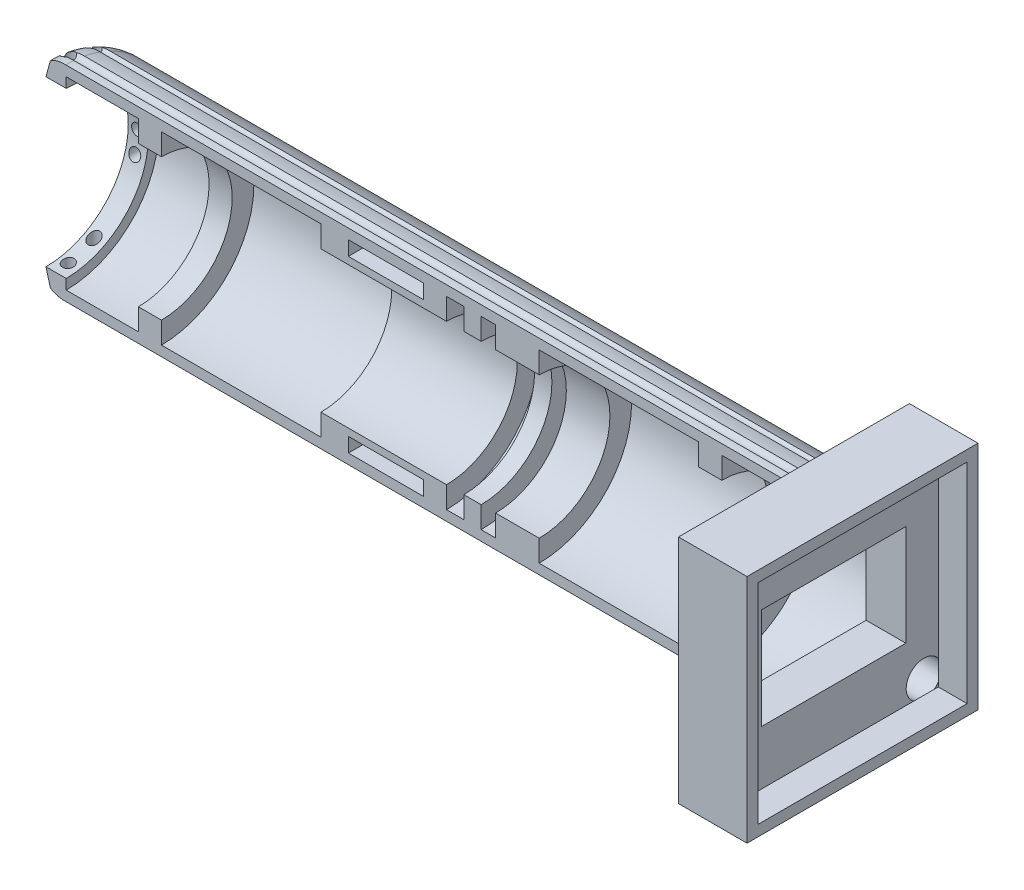
from build123d import *

# Parameters (mm, degrees)
REVOLVE1_ANGLE      = 180
SKETCH3_W           = 5.2
SKETCH3_H           = 1
CUT_EXTRUDE1_DEPTH  = 1.5
SKETCH4_R           = 0.4
CUT_EXTRUDE2_DEPTH  = 18
CUT_EXTRUDE3_START  = 40
SKETCH4_2_R         = 0.4
CUT_EXTRUDE3_DEPTH  = 40
SKETCH5_W           = 0.4
SKETCH5_H           = 5.163222067
SKETCH6_W           = 0.4
SKETCH6_H           = 4.314956679
SKETCH8_W           = 2.905461843
SKETCH8_H           = 0.4
SKETCH17_W          = 2.6
SKETCH17_H          = 0.4
SKETCH9_W           = 0.4
SKETCH9_H           = 3.299980091
SKETCH10_W          = 0.4
SKETCH10_H          = 2.940266621
SKETCH11_W          = 16
SKETCH11_H          = 16
SKETCH11_W_2        = 10
SKETCH11_H_2        = 7
BOSS_EXTRUDE1_DEPTH = 4.75
SKETCH12_W          = 14.5
SKETCH12_H          = 14.5
CUT_EXTRUDE4_DEPTH  = 2
SKETCH18_R          = 1.225
SKETCH18_R_2        = 0.65
CUT_EXTRUDE5_DEPTH  = 5
SKETCH19_R          = 1.2
CUT_EXTRUDE6_DEPTH  = 1.3


with BuildPart() as part:
    # Sketch1 → Revolve1 (revolve)
    with BuildSketch(Plane.XY):
        with BuildLine():
            Line((-17.15876881, 0), (33.289966832, 0))
            Line((33.289966832, 0), (33.289966832, 0.7))
            Line((33.289966832, 0.7), (28.289966832, 0.7))
            Line((28.289966832, 0.7), (28.289966832, 2.2))
            Line((28.289966832, 2.2), (26.689966832, 2.2))
            Line((26.689966832, 2.2), (26.689966832, 0.7))
            Line((26.689966832, 0.7), (15.639966832, 0.7))
            Line((15.639966832, 0.7), (15.639966832, 2.2))
            Line((15.639966832, 2.2), (12.619966832, 2.2))
            Line((12.619966832, 2.2), (12.619966832, 0.7))
            Line((12.619966832, 0.7), (11.619966832, 0.7))
            Line((11.619966832, 0.7), (11.619966832, 2.2))
            Line((11.619966832, 2.2), (10.419966832, 2.2))
            Line((10.419966832, 2.2), (10.419966832, 0.7))
            Line((10.419966832, 0.7), (9.219966832, 0.7))
            Line((9.219966832, 0.7), (9.219966832, 2.2))
            Line((9.219966832, 2.2), (0.519966832, 2.2))
            Line((0.519966832, 2.2), (0.519966832, 0.7))
            Line((0.519966832, 0.7), (-10.530033168, 0.7))
            Line((-10.530033168, 0.7), (-10.530033168, 2.2))
            Line((-10.530033168, 2.2), (-12.130033168, 2.2))
            Line((-12.130033168, 2.2), (-12.130033168, 0.7))
            Line((-12.130033168, 0.7), (-17.130033168, 0.7))
            Line((-17.130033168, 0.7), (-17.130033168, 1.4))
            Line((-17.130033168, 1.4), (-18.530033168, 1.4))
            Line((-18.530033168, 1.4), (-18.230033168, 0.280384758))
            ThreePointArc((-18.230033168, 0.280384758), (-17.716498042, 0.055766303), (-17.15876881, 0))
        make_face()
    revolve(axis=Axis((-19.05, 7.1, 0), (1, 0, 0)), revolution_arc=REVOLVE1_ANGLE)

    # Sketch3 → Cut-Extrude1 (cut)
    with BuildSketch(Plane.XY):
        with Locations((5.019966832, 13)):
            Rectangle(SKETCH3_W, SKETCH3_H)
        with Locations((5.019966832, 1.2)):
            Rectangle(SKETCH3_W, SKETCH3_H)
    extrude(amount=-CUT_EXTRUDE1_DEPTH, mode=Mode.SUBTRACT)

    # Sketch4 → Cut-Extrude2 (cut)
    with BuildSketch(Plane(origin=(0, 0, 0), x_dir=(0, 0, -1), z_dir=(1, 0, 0))):
        with Locations((0.946314894, 14.287975245)):
            Circle(SKETCH4_R)
        with Locations((7.25, 7.1)):
            Circle(SKETCH4_R)
        with Locations((2.774454885, 13.798126611)):
            Circle(SKETCH4_R)
        with Locations((7.034644016, 8.853933743)):
            Circle(SKETCH4_R)
        with Locations((7.034644016, 5.346066257)):
            Circle(SKETCH4_R)
        with Locations((2.774454885, 0.401873389)):
            Circle(SKETCH4_R)
        with Locations((0.946314894, -0.087975245)):
            Circle(SKETCH4_R)
    extrude(amount=-CUT_EXTRUDE2_DEPTH, mode=Mode.SUBTRACT)

    # Sketch4<2> → Cut-Extrude3 (cut)
    with BuildSketch(Plane(origin=(0, 0, 0), x_dir=(0, 0, -1), z_dir=(1, 0, 0)).offset(CUT_EXTRUDE3_START)):
        with Locations((0.946314894, 14.287975245)):
            Circle(SKETCH4_2_R)
        with Locations((7.25, 7.1)):
            Circle(SKETCH4_2_R)
        with Locations((2.774454885, 13.798126611)):
            Circle(SKETCH4_2_R)
        with Locations((7.034644016, 8.853933743)):
            Circle(SKETCH4_2_R)
        with Locations((7.034644016, 5.346066257)):
            Circle(SKETCH4_2_R)
        with Locations((2.774454885, 0.401873389)):
            Circle(SKETCH4_2_R)
        with Locations((0.946314894, -0.087975245)):
            Circle(SKETCH4_2_R)
    extrude(amount=-CUT_EXTRUDE3_DEPTH, mode=Mode.SUBTRACT)

    # Sketch5 → Cut-Revolve1 (revolve, cut)
    with BuildSketch(Plane.ZY.offset(17.9)):
        with Locations((-0.718334844, 12.675709105)):
            Rectangle(SKETCH5_W, SKETCH5_H)
    revolve(axis=Axis((-17.9, 10.094098071, -0.918334844), (0, 1, 0)), mode=Mode.SUBTRACT)

    # Sketch6 → Cut-Revolve2 (revolve, cut)
    with BuildSketch(Plane.ZY.offset(17.9)):
        with Locations((-2.492421531, 12.80190648)):
            Rectangle(SKETCH6_W, SKETCH6_H)
    revolve(axis=Axis((-17.9, 10.64442814, -2.692421531), (0, 1, 0)), mode=Mode.SUBTRACT)

    # Sketch7 → Cut-Revolve3 (revolve, cut)
    with BuildSketch(Plane.ZY.offset(17.9)):
        Polygon((-7.197799556, 8.779923419), (-7.185065829, 9.179923419), (-4.585065829, 9.179923419), (-4.597799556, 8.779923419), align=None)
    revolve(axis=Axis((-17.9, 8.779923419, 0.042513891), (0, 0, -1)), mode=Mode.SUBTRACT)

    # Sketch8 → Cut-Revolve4 (revolve, cut)
    with BuildSketch(Plane.ZY.offset(17.9)):
        with Locations((-5.679378963, 5.495348035)):
            Rectangle(SKETCH8_W, SKETCH8_H)
    revolve(axis=Axis((-17.9, 5.695348035, -7.132109885), (0, 0, 1)), mode=Mode.SUBTRACT)

    # Sketch17 → Cut-Revolve7 (revolve, cut)
    with BuildSketch(Plane.ZY.offset(17.9)):
        with Locations((-5.884516749, 6.9)):
            Rectangle(SKETCH17_W, SKETCH17_H)
    revolve(axis=Axis((-17.9, 7.1, -7.567048599), (0, 0, 1)), mode=Mode.SUBTRACT)

    # Sketch9 → Cut-Revolve5 (revolve, cut)
    with BuildSketch(Plane.ZY.offset(17.9)):
        with Locations((-2.492421531, 1.925145492)):
            Rectangle(SKETCH9_W, SKETCH9_H)
    revolve(axis=Axis((-17.9, 0.275155446, -2.692421531), (0, 1, 0)), mode=Mode.SUBTRACT)

    # Sketch10 → Cut-Revolve6 (revolve, cut)
    with BuildSketch(Plane.ZY.offset(17.9)):
        with Locations((-0.718334844, 1.817780982)):
            Rectangle(SKETCH10_W, SKETCH10_H)
    revolve(axis=Axis((-17.9, 0.222529942, -0.918334844), (0, 1, 0)), mode=Mode.SUBTRACT)

    # Sketch11 → Boss-Extrude1 (add)
    with BuildSketch(Plane(origin=(33.289966832, 0, 0), x_dir=(0, 0, -1), z_dir=(1, 0, 0))):
        with Locations((0, 7.1)):
            Rectangle(SKETCH11_W, SKETCH11_H)
        with Locations((0, 7.1)):
            Rectangle(SKETCH11_W_2, SKETCH11_H_2, mode=Mode.SUBTRACT)
    extrude(amount=BOSS_EXTRUDE1_DEPTH)

    # Sketch12 → Cut-Extrude4 (cut)
    with BuildSketch(Plane(origin=(38.039966832, 0, 0), x_dir=(0, 0, -1), z_dir=(1, 0, 0))):
        with Locations((0, 7.1)):
            Rectangle(SKETCH12_W, SKETCH12_H)
    extrude(amount=-CUT_EXTRUDE4_DEPTH, mode=Mode.SUBTRACT)

    # Sketch18 → Cut-Extrude5 (cut)
    with BuildSketch(Plane(origin=(36.039966832, 0, 0), x_dir=(0, 0, -1), z_dir=(1, 0, 0))):
        with Locations((-6.25, 13.35)):
            Circle(SKETCH18_R)
        with Locations((6.25, 0.85)):
            Circle(SKETCH18_R)
        with Locations((6.25, 13.35)):
            Circle(SKETCH18_R_2)
        with Locations((-6.25, 0.85)):
            Circle(SKETCH18_R_2)
    extrude(amount=-CUT_EXTRUDE5_DEPTH, mode=Mode.SUBTRACT)

    # Sketch19 → Cut-Extrude6 (cut)
    with BuildSketch(Plane.ZY.offset(-33.289966832)):
        with Locations((-6.25, 13.35)):
            Circle(SKETCH19_R)
        with Locations((6.25, 0.85)):
            Circle(SKETCH19_R)
    extrude(amount=-CUT_EXTRUDE6_DEPTH, mode=Mode.SUBTRACT)


solid = part.part
